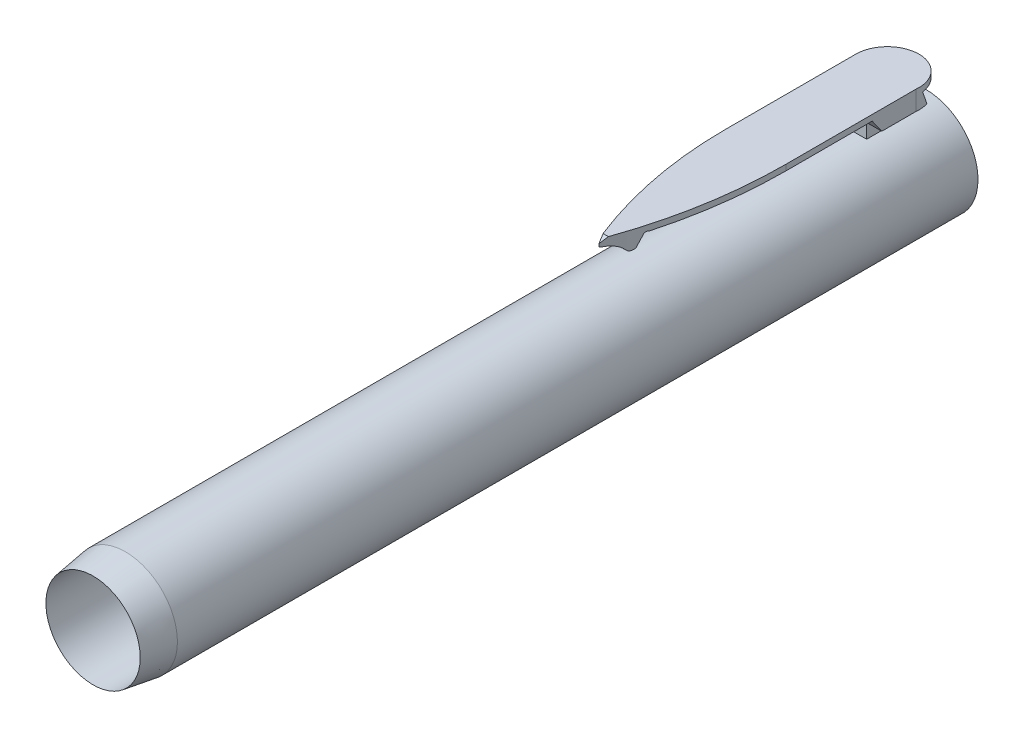
from build123d import *

# Parameters (mm, degrees)
SKETCH3_W           = 3.521922762
SKETCH3_H           = 6.07537554
BOSS_EXTRUDE1_DEPTH = 1.905
BOSS_EXTRUDE2_DEPTH = 2.54
CUT_EXTRUDE2_DEPTH  = 111.307012646


with BuildPart() as part:
    # Sketch2 → Revolve1 (revolve)
    with BuildSketch(Plane(origin=(0, 0, 0), x_dir=(0, 0, -1), z_dir=(1, 0, 0))):
        Polygon((0, 6.1849), (106.746901339, 6.1849), (106.746901339, 3.81), (109.22, 3.81), (109.22, 6.1849), (109.22, 6.8199), (4.239390289, 6.8199), align=None)
    revolve(axis=Axis((0, 0, 0), (0, 0, -1)))


with BuildPart() as body_2:
    # Sketch3 → Boss-Extrude1 (new body)
    with BuildSketch(Plane(origin=(0, 6.8199, 0), x_dir=(1, 0, 0), z_dir=(0, 1, 0))):
        with Locations((0, 102.71450048)):
            Rectangle(SKETCH3_W, SKETCH3_H)
    extrude(amount=BOSS_EXTRUDE1_DEPTH)

    # Sketch4 → Boss-Extrude2 (add)
    with BuildSketch(Plane(origin=(0, 8.7249, 0), x_dir=(1, 0, 0), z_dir=(0, 1, 0))):
        with BuildLine():
            Line((-4.172743681, 104.160601623), (-4.172743681, 87.113896477))
            ThreePointArc((-4.172743681, 87.113896477), (-3.119236981, 76.522288583), (0, 66.345727533))
            ThreePointArc((0, 66.345727533), (2.805257987, 76.561857132), (3.750372795, 87.113896477))
            Line((3.750372795, 87.113896477), (3.750372795, 104.160601623))
            ThreePointArc((3.750372795, 104.160601623), (2.805222181, 107.082869738), (0, 108.333345304))
            ThreePointArc((0, 108.333345304), (-2.950575353, 107.111176976), (-4.172743681, 104.160601623))
        make_face()
    extrude(amount=BOSS_EXTRUDE2_DEPTH)

    # Sketch5 → Cut-Extrude2 (cut, through all)
    with BuildSketch(Plane(origin=(3.750372795, 0, 0), x_dir=(0, 0, -1), z_dir=(1, 0, 0))):
        with BuildLine():
            Line((67.1000348, 10.217368222), (66.345727533, 10.345449312))
            Line((66.345727533, 10.345449312), (66.345727533, 8.7249))
            Line((66.345727533, 8.7249), (99.67681271, 8.7249))
            Line((99.67681271, 8.7249), (98.413073124, 10.504307386))
            Line((98.413073124, 10.504307386), (71.326942087, 10.504307386))
            ThreePointArc((71.326942087, 10.504307386), (70.989862042, 10.550873607), (70.718583167, 10.345449312))
            Line((70.718583167, 10.345449312), (69.994340058, 9.109296751))
            ThreePointArc((69.994340058, 9.109296751), (69.46263006, 8.929174901), (68.959288933, 9.177785265))
            ThreePointArc((68.959288933, 9.177785265), (68.119325888, 9.857937398), (67.1000348, 10.217368222))
        make_face()
        Polygon((66.345727533, 10.765017716), (67.243856936, 11.2649), (66.345727533, 11.2649), align=None)
        Polygon((108.333345304, 10.512302611), (105.028366221, 10.512302611), (105.75218825, 8.7249), (108.333345304, 8.7249), align=None)
    extrude(amount=-CUT_EXTRUDE2_DEPTH, mode=Mode.SUBTRACT)


solid = Compound([part.part, body_2.part])
